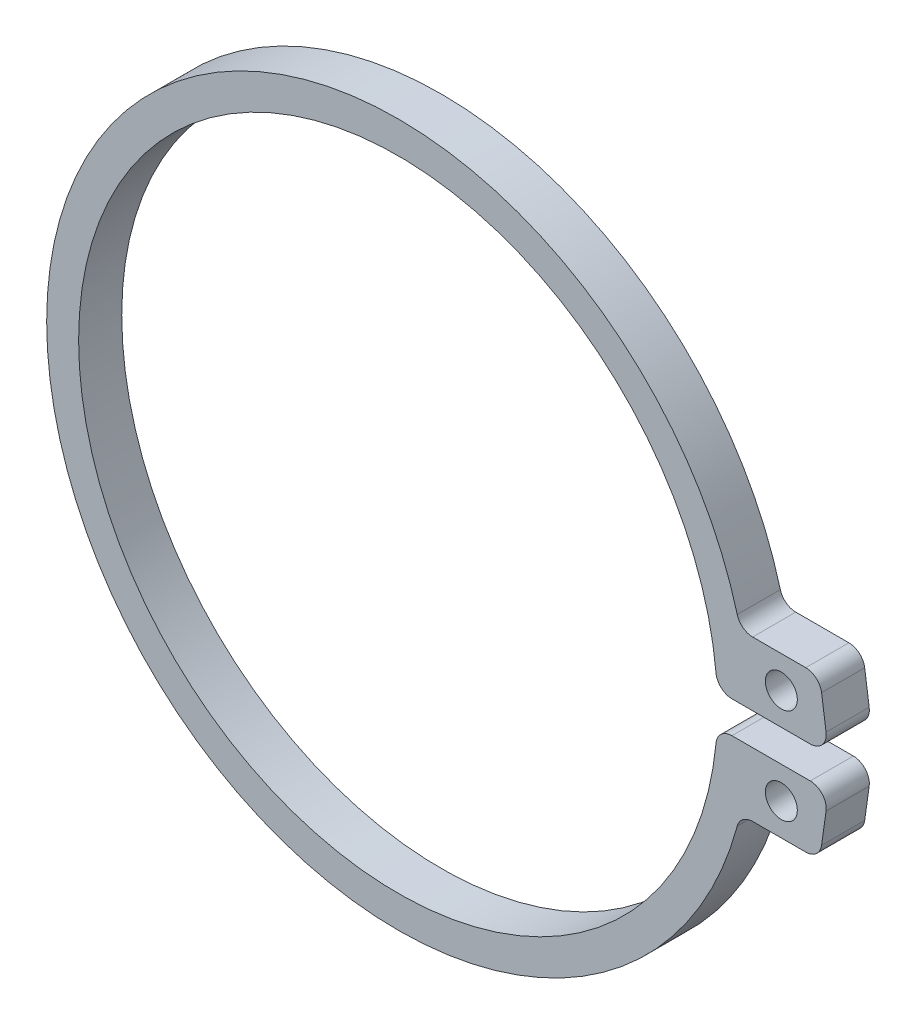
from build123d import *

# Parameters (mm, degrees)
SKETCH1_R           = 0.5
BOSS_EXTRUDE1_DEPTH = 0.675


with BuildPart() as part:
    # Sketch1 → Boss-Extrude1 (new, symmetric)
    with BuildSketch(Plane(origin=(0, 0, 0), x_dir=(0, 1, 0), z_dir=(0, 0, 1))):
        with BuildLine():
            Line((-0.5, -10.45227248), (-0.5, -12.904865966))
            ThreePointArc((-0.5, -12.904865966), (-0.671970486, -13.282220756), (-1.06958655, -13.4))
            Line((-1.06958655, -13.4), (-2.06958655, -13.259459165))
            ThreePointArc((-2.06958655, -13.259459165), (-2.37735479, -13.092354645), (-2.5, -12.764325131))
            Line((-2.5, -12.764325131), (-2.5, -11.101801656))
            ThreePointArc((-2.5, -11.101801656), (-2.603000383, -10.797842276), (-2.869565217, -10.619114627))
            ThreePointArc((-2.869565217, -10.619114627), (0, 11), (2.869565217, -10.619114627))
            ThreePointArc((2.869565217, -10.619114627), (2.603000383, -10.797842276), (2.5, -11.101801656))
            Line((2.5, -11.101801656), (2.5, -12.764325131))
            ThreePointArc((2.5, -12.764325131), (2.37735479, -13.092354645), (2.06958655, -13.259459165))
            Line((2.06958655, -13.259459165), (1.06958655, -13.4))
            ThreePointArc((1.06958655, -13.4), (0.671970486, -13.282220756), (0.5, -12.904865966))
            Line((0.5, -12.904865966), (0.5, -10.45227248))
            ThreePointArc((0.5, -10.45227248), (0.629993565, -10.115976126), (0.952380952, -9.954545219))
            ThreePointArc((0.952380952, -9.954545219), (0, 10), (-0.952380952, -9.954545219))
            ThreePointArc((-0.952380952, -9.954545219), (-0.629993565, -10.115976126), (-0.5, -10.45227248))
        make_face()
        with Locations(Location((-1.5, -12, 0), (0, 0, 270))):
            Circle(SKETCH1_R, mode=Mode.SUBTRACT)
        with Locations(Location((1.5, -12, 0), (0, 0, 90))):
            Circle(SKETCH1_R, mode=Mode.SUBTRACT)
    extrude(amount=BOSS_EXTRUDE1_DEPTH, both=True)


solid = part.part
